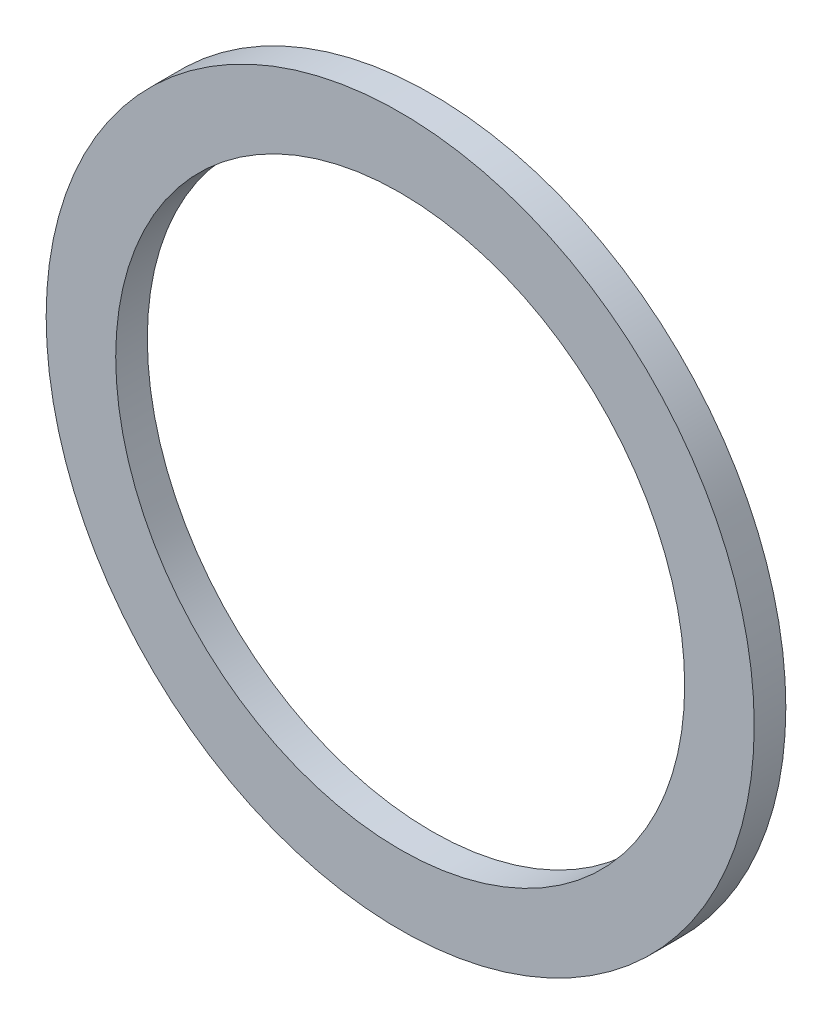
from build123d import *

# Parameters (mm, degrees)
CROQUIS1_R              = 11.2
CROQUIS1_R_2            = 9
SALIENTE_EXTRUIR1_DEPTH = 1


with BuildPart() as part:
    # Croquis1 → Saliente-Extruir1 (new body)
    with BuildSketch(Plane.XY):
        Circle(CROQUIS1_R)
        Circle(CROQUIS1_R_2, mode=Mode.SUBTRACT)
    extrude(amount=SALIENTE_EXTRUIR1_DEPTH)


solid = part.part
